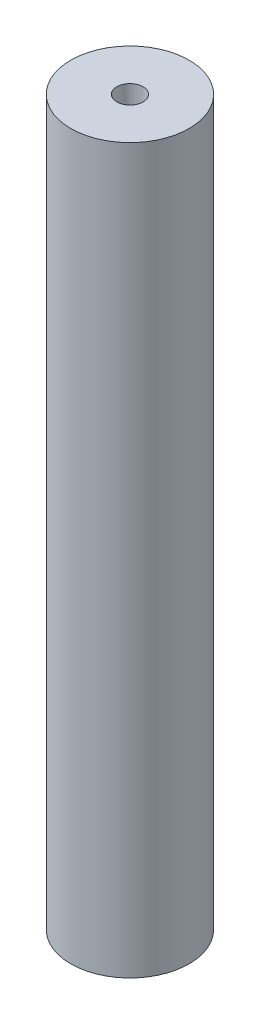
from build123d import *

# Parameters (mm, degrees)
SKETCH_1_R      = 9
SKETCH_1_R_2    = 2
EXTRUDE_1_DEPTH = 110


with BuildPart() as part:
    # 草图1 → 凸台-拉伸1 (new body)
    with BuildSketch(Plane(origin=(0, 0, 0), x_dir=(1, 0, 0), z_dir=(0, 1, 0))):
        with Locations(Location((0, 0, 0), (0, 0, 270))):
            Circle(SKETCH_1_R)
        with Locations(Location((0, 0, 0), (0, 0, 270))):
            Circle(SKETCH_1_R_2, mode=Mode.SUBTRACT)
    extrude(amount=EXTRUDE_1_DEPTH)


solid = part.part
